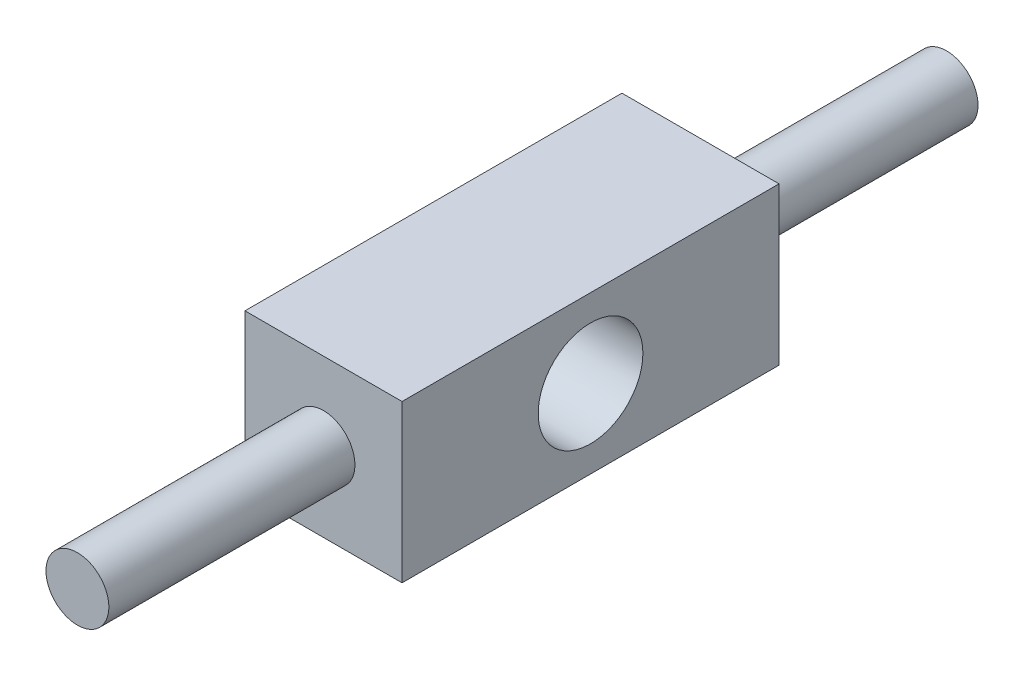
from build123d import *

# Parameters (mm, degrees)
SKETCH2_W           = 150
SKETCH2_H           = 150
BOSS_EXTRUDE1_DEPTH = 180
SKETCH5_R           = 30
BOSS_EXTRUDE3_DEPTH = 235
SKETCH7_R           = 50
CUT_EXTRUDE1_DEPTH  = 448.993409814


with BuildPart() as part:
    # Sketch2 → Boss-Extrude1 (new body)
    with BuildSketch(Plane.XY):
        with Locations((22.391402768, 2.285802295)):
            Rectangle(SKETCH2_W, SKETCH2_H)
    boss_extrude1 = extrude(amount=BOSS_EXTRUDE1_DEPTH)

    # Sketch5 → Boss-Extrude3 (add)
    with BuildSketch(Plane.XY.offset(180)):
        with Locations(Location((22.391402768, 2.285802295, 0), (0, 0, 180))):
            Circle(SKETCH5_R)
    boss_extrude3 = extrude(amount=BOSS_EXTRUDE3_DEPTH)

    # Mirror1: Boss-Extrude1, Boss-Extrude3 across plane
    add(boss_extrude1.mirror(Plane.XY))
    add(boss_extrude3.mirror(Plane.XY))

    # Sketch7 → Cut-Extrude1 (cut, through all)
    with BuildSketch(Plane(origin=(97.391402768, 0, 0), x_dir=(0, 0, -1), z_dir=(1, 0, 0))):
        with Locations((0, 2.285802295)):
            Circle(SKETCH7_R)
    extrude(amount=-CUT_EXTRUDE1_DEPTH, mode=Mode.SUBTRACT)


solid = part.part
